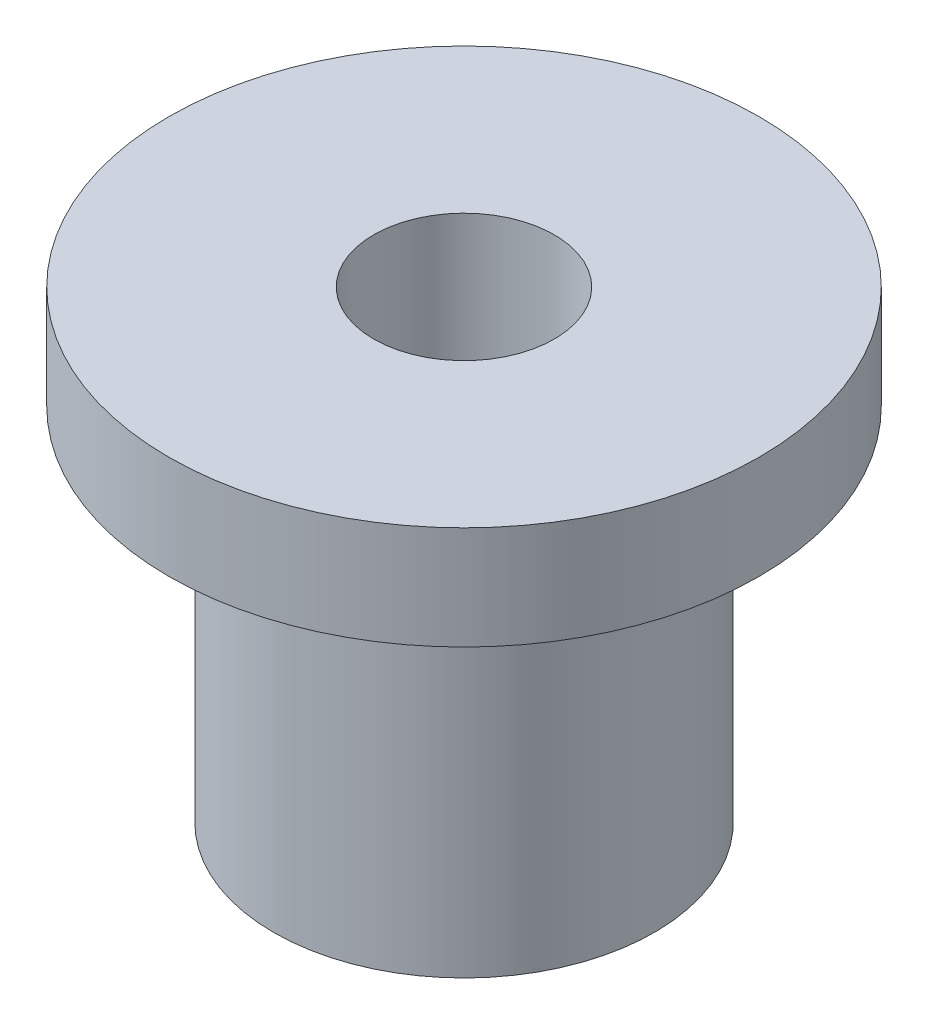
from build123d import *

# Parameters (mm, degrees)
SKETCH1_R           = 3.687
SKETCH1_R_2         = 1.75
BOSS_EXTRUDE1_DEPTH = 6.985
SKETCH2_R           = 5.715
SKETCH2_R_2         = 1.75
BOSS_EXTRUDE2_DEPTH = 2
FILLET1_R           = 0.5


with BuildPart() as part:
    # Sketch1 → Boss-Extrude1 (new body)
    with BuildSketch(Plane(origin=(0, 0, 0), x_dir=(1, 0, 0), z_dir=(0, 1, 0))):
        with Locations(Location((0, 0, 0), (0, 0, 270))):
            Circle(SKETCH1_R)
        with Locations(Location((0, 0, 0), (0, 0, 270))):
            Circle(SKETCH1_R_2, mode=Mode.SUBTRACT)
    extrude(amount=BOSS_EXTRUDE1_DEPTH)

    # Sketch2 → Boss-Extrude2 (add)
    with BuildSketch(Plane(origin=(0, 6.985, 0), x_dir=(1, 0, 0), z_dir=(0, 1, 0))):
        with Locations(Location((0, 0, 0), (0, 0, 270))):
            Circle(SKETCH2_R)
        with Locations(Location((0, 0, 0), (0, 0, 270))):
            Circle(SKETCH2_R_2, mode=Mode.SUBTRACT)
    extrude(amount=BOSS_EXTRUDE2_DEPTH)

    # Fillet1
    fillet1_edges = [part.edges().sort_by_distance(p)[0] for p in [
        (0, 6.985, -3.687),
    ]]
    fillet(fillet1_edges, radius=FILLET1_R)


solid = part.part
